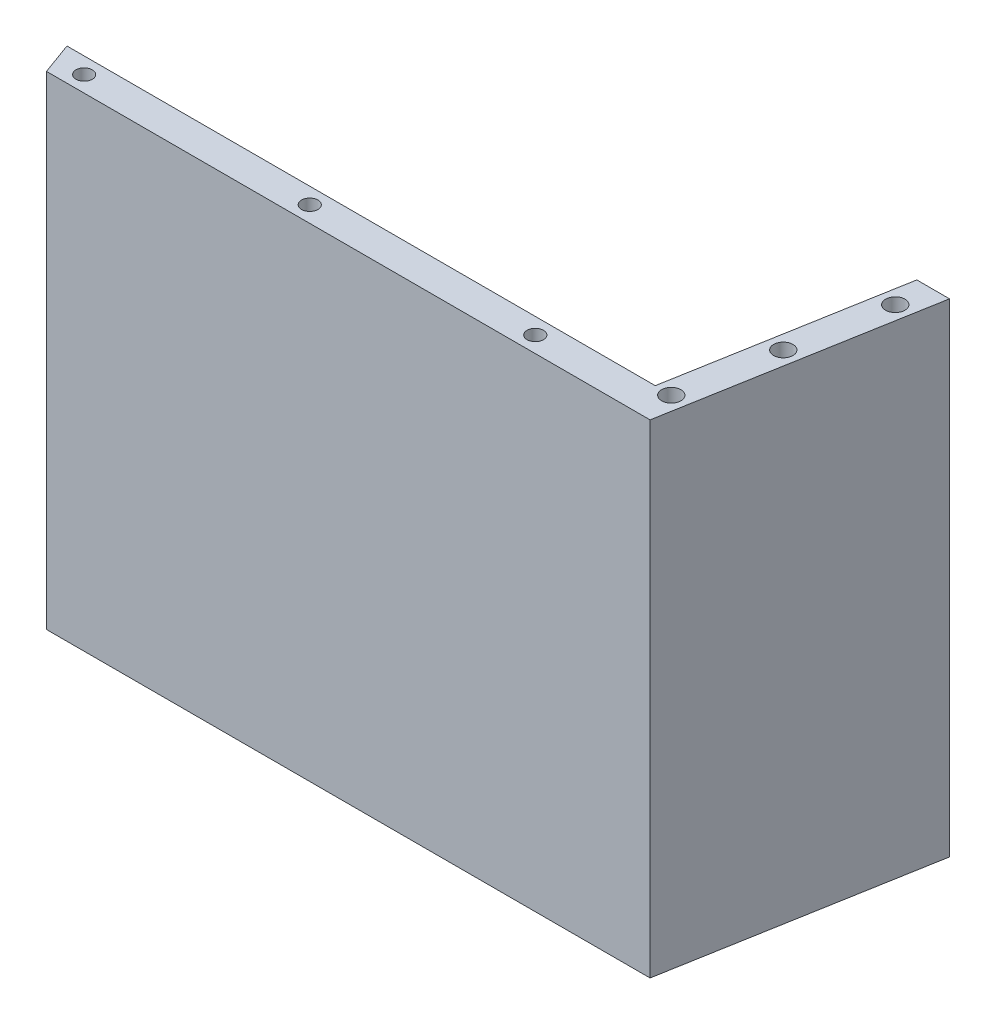
from build123d import *

# Parameters (mm, degrees)
BOSS_EXTRUDE1_DEPTH = 37.5
SKETCH2_R           = 1.271589992
SKETCH2_R_2         = 1.5
CUT_EXTRUDE1_DEPTH  = 15


with BuildPart() as part:
    # Sketch1 → Boss-Extrude1 (new body)
    with BuildSketch(Plane(origin=(0, 0, 0), x_dir=(-1, 0, 0), z_dir=(0, 1, 0))):
        Polygon((28.132122167, -13), (-65.526137841, -13), (-72.491053579, -52.5), (-67.41392052, -52.5), (-61.330639685, -18), (29.951973339, -18), align=None)
    extrude(amount=BOSS_EXTRUDE1_DEPTH)

    # Sketch2 → Cut-Extrude1 (cut)
    with BuildSketch(Plane(origin=(0, 37.5, 0), x_dir=(-1, 0, 0), z_dir=(0, 1, 0))):
        with Locations(Location((-45.214663337, -15.5, 0), (0, 0, 90))):
            Circle(SKETCH2_R)
        with Locations(Location((-10.214663337, -15.5, 0), (0, 0, 90))):
            Circle(SKETCH2_R)
        with Locations(Location((24.785336663, -15.5, 0), (0, 0, 90))):
            Circle(SKETCH2_R)
        with Locations(Location((-69.070852146, -47.5, 0), (0, 0, 90))):
            Circle(SKETCH2_R_2)
        with Locations(Location((-66.466129481, -32.727883705, 0), (0, 0, 90))):
            Circle(SKETCH2_R_2)
        with Locations(Location((-63.861406816, -17.95576741, 0), (0, 0, 90))):
            Circle(SKETCH2_R_2)
    extrude(amount=-CUT_EXTRUDE1_DEPTH, mode=Mode.SUBTRACT)

    # Mirror1: part across plane


with BuildPart() as part_1:
    add(part.part)
    add(part.part.mirror(Plane(origin=(0, 0, 0), x_dir=(0, 0, 1), z_dir=(0, -1, 0))))


solid = part_1.part
